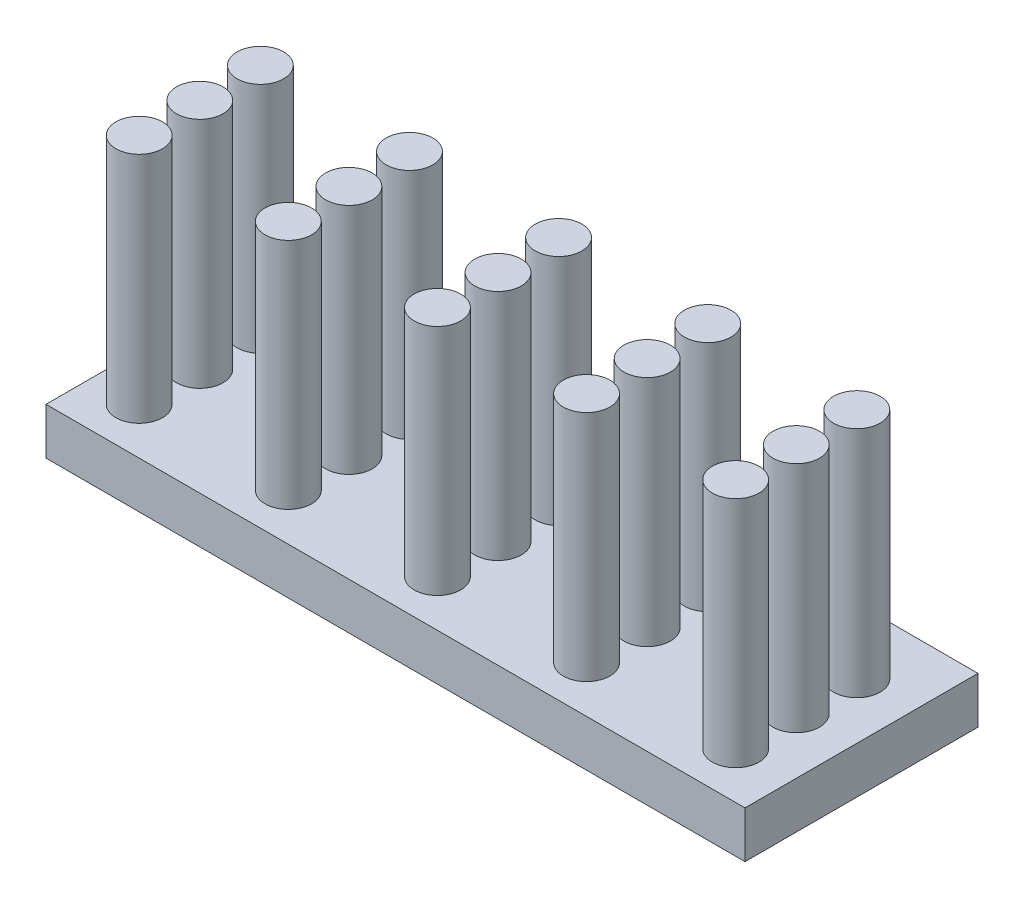
from build123d import *

# Parameters (mm, degrees)
ESQUISSE1_W                     = 150
ESQUISSE1_H                     = 50
BOSS_EXTRU_1_DEPTH              = 10
ESQUISSE2_R                     = 5
BOSS_EXTRU_2_DEPTH              = 50
R_P_TITION_LIN_AIRE1_COUNT      = 5
R_P_TITION_LIN_AIRE1_PITCH      = 32
R_P_TITION_LIN_AIRE1_COUNT_DIR2 = 3
R_P_TITION_LIN_AIRE1_PITCH_DIR2 = 13


with BuildPart() as part:
    # Esquisse1 → Boss.-Extru.1 (new body)
    with BuildSketch(Plane(origin=(0, 0, 0), x_dir=(1, 0, 0), z_dir=(0, 1, 0))):
        Rectangle(ESQUISSE1_W, ESQUISSE1_H)
    extrude(amount=BOSS_EXTRU_1_DEPTH)

    # Esquisse2 → Boss.-Extru.2 (add)
    with BuildSketch(Plane(origin=(0, 10, 0), x_dir=(1, 0, 0), z_dir=(0, 1, 0))):
        with Locations(Location((-65, -15, 0), (0, 0, 270))):
            Circle(ESQUISSE2_R)
    boss_extru_2 = extrude(amount=BOSS_EXTRU_2_DEPTH)

    # Répétition linéaire1: Boss.-Extru.2 5 × 3
    with Locations(*[(i * R_P_TITION_LIN_AIRE1_PITCH, 0, -j * R_P_TITION_LIN_AIRE1_PITCH_DIR2) for i in range(R_P_TITION_LIN_AIRE1_COUNT) for j in range(R_P_TITION_LIN_AIRE1_COUNT_DIR2) if (i, j) != (0, 0)]):
        add(boss_extru_2)


solid = part.part
